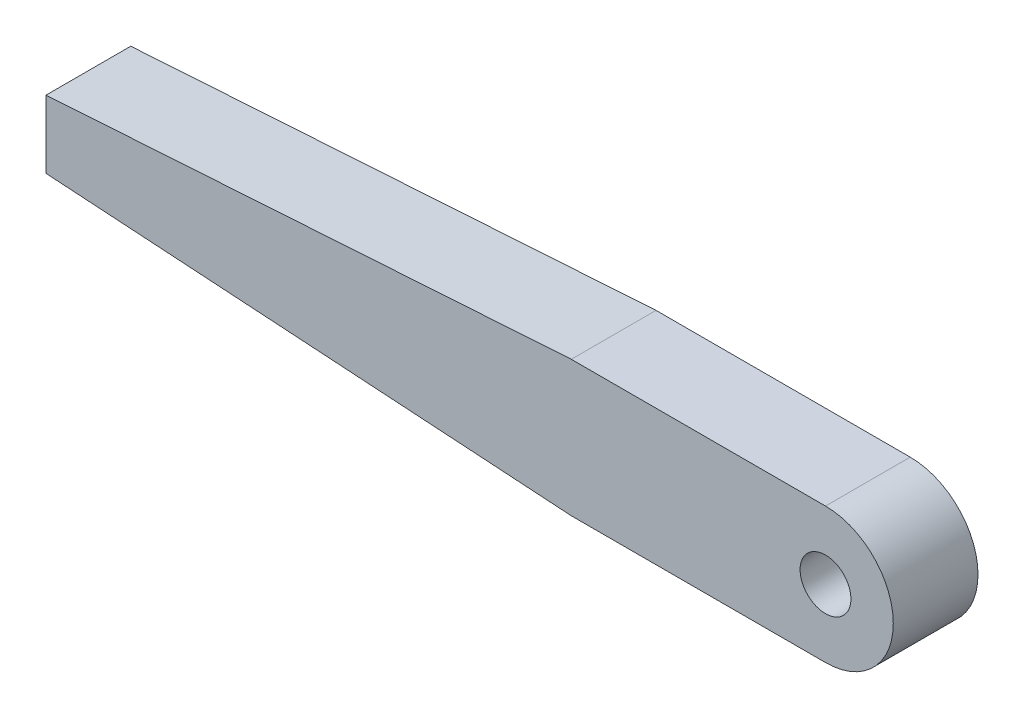
from build123d import *

# Parameters (mm, degrees)
ESQUISSE1_R        = 1.5
BOSS_EXTRU_1_DEPTH = 5


with BuildPart() as part:
    # Esquisse1 → Boss.-Extru.1 (new body)
    with BuildSketch(Plane.XY):
        with BuildLine():
            Line((6, 4), (21, 4))
            ThreePointArc((21, 4), (25, 0), (21, -4))
            Line((21, -4), (6, -4))
            Line((6, -4), (-25, -2))
            Line((-25, -2), (-25, 2))
            Line((-25, 2), (6, 4))
        make_face()
        with Locations((21, 0)):
            Circle(ESQUISSE1_R, mode=Mode.SUBTRACT)
    extrude(amount=BOSS_EXTRU_1_DEPTH)


solid = part.part
